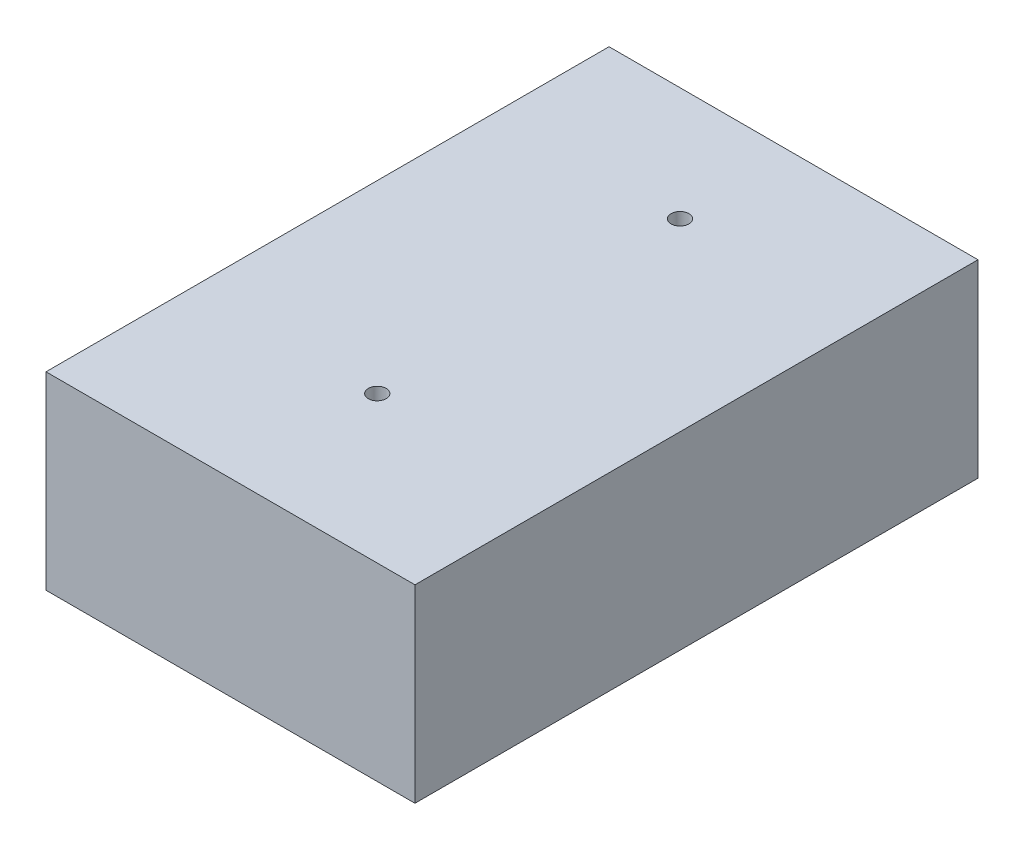
from build123d import *

# Parameters (mm, degrees)
SKETCH1_W           = 61.9125
SKETCH1_H           = 94.479888928
BOSS_EXTRUDE1_DEPTH = 31.75
SKETCH2_R           = 1.5
CUT_EXTRUDE1_DEPTH  = 2.54


with BuildPart() as part:
    # Sketch1 → Boss-Extrude1 (new body)
    with BuildSketch(Plane(origin=(0, 0, 0), x_dir=(1, 0, 0), z_dir=(0, 1, 0))):
        Rectangle(SKETCH1_W, SKETCH1_H)
    extrude(amount=BOSS_EXTRUDE1_DEPTH)

    # Sketch2 → Cut-Extrude1 (cut)
    with BuildSketch(Plane(origin=(0, 31.75, 0), x_dir=(1, 0, 0), z_dir=(0, 1, 0))):
        with Locations(Location((0, 28.189944464, 0), (0, 0, 270))):
            Circle(SKETCH2_R)
        with Locations(Location((0, -22.610055536, 0), (0, 0, 270))):
            Circle(SKETCH2_R)
    extrude(amount=-CUT_EXTRUDE1_DEPTH, mode=Mode.SUBTRACT)


solid = part.part
